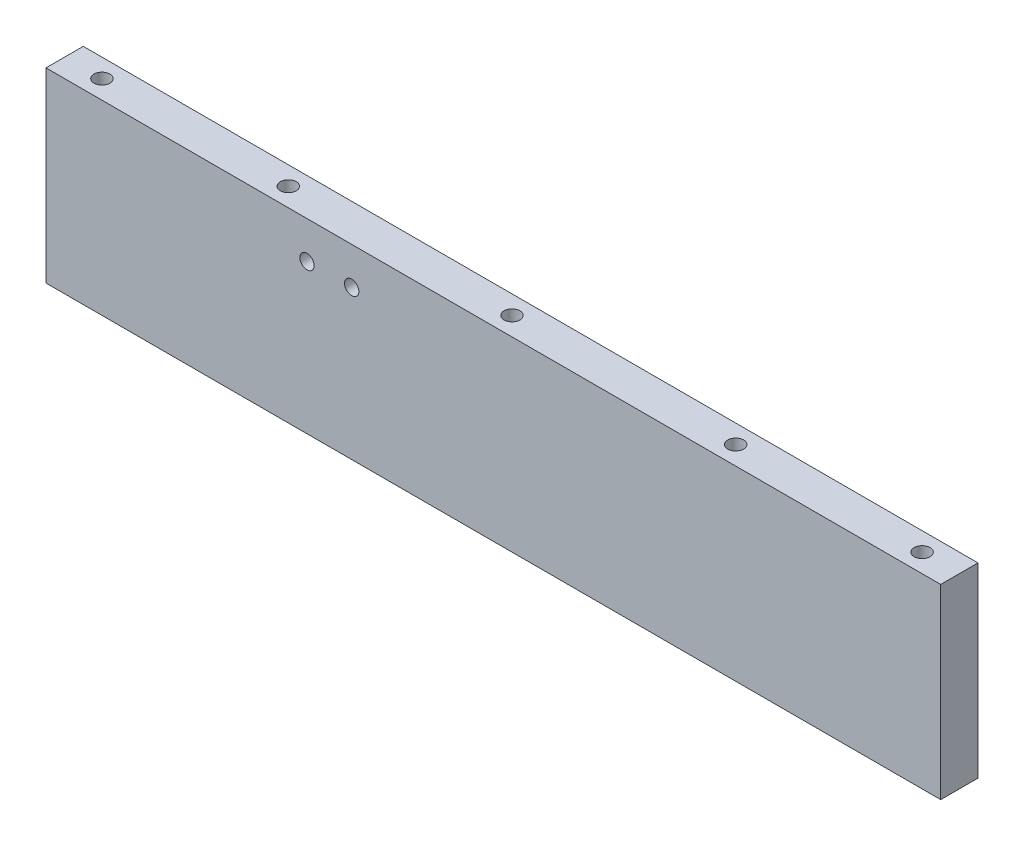
from build123d import *

# Parameters (mm, degrees)
SKETCH1_W                          = 152.4
SKETCH1_H                          = 31.75
BOSS_EXTRUDE1_DEPTH                = 6.35
F_2_CLEARANCE_HOLE1_D              = 2.4384
TAP_DRILL_FOR_6_32_TAP1_AT_2_COUNT = 2
TAP_DRILL_FOR_6_32_TAP1_AT_2_PITCH = 31.75
TAP_DRILL_FOR_6_32_TAP1_AT_3_COUNT = 2
TAP_DRILL_FOR_6_32_TAP1_AT_3_PITCH = 69.85
TAP_DRILL_FOR_6_32_TAP1_AT_4_COUNT = 2
TAP_DRILL_FOR_6_32_TAP1_AT_4_PITCH = 107.95
TAP_DRILL_FOR_6_32_TAP1_AT_5_COUNT = 2
TAP_DRILL_FOR_6_32_TAP1_AT_5_PITCH = 139.7


with BuildPart() as part:
    # Sketch1 → Boss-Extrude1 (new body)
    with BuildSketch(Plane.XY):
        Rectangle(SKETCH1_W, SKETCH1_H)
    extrude(amount=-BOSS_EXTRUDE1_DEPTH)

    # #2 Clearance Hole1 (through all)
    with Locations(Plane.XY):
        with Locations((-31.75, 9.525), (-24.13, 9.525)):
            Hole(F_2_CLEARANCE_HOLE1_D / 2)

    # Sketch7 → Tap Drill for #6-32 Tap1 (revolve, cut)
    with BuildSketch(Plane(origin=(-69.85, 15.875, -3.175), x_dir=(0, 0, 1), z_dir=(1, 0, 0))):
        Polygon((0, 0), (0, 13.51269403), (1.35255, 12.7), (1.35255, 0), align=None)
    tap_drill_for_6_32_tap1 = revolve(axis=Axis((-69.85, 22.225, -3.175), (0, -1, 0)), mode=Mode.SUBTRACT)

    # Tap Drill for #6-32 Tap1 at 2: Tap Drill for #6-32 Tap1 ×2
    with Locations(*[(i * TAP_DRILL_FOR_6_32_TAP1_AT_2_PITCH, 0, 0) for i in range(1, TAP_DRILL_FOR_6_32_TAP1_AT_2_COUNT)]):
        add(tap_drill_for_6_32_tap1, mode=Mode.SUBTRACT)

    # Tap Drill for #6-32 Tap1 at 3: Tap Drill for #6-32 Tap1 ×2
    with Locations(*[(i * TAP_DRILL_FOR_6_32_TAP1_AT_3_PITCH, 0, 0) for i in range(1, TAP_DRILL_FOR_6_32_TAP1_AT_3_COUNT)]):
        add(tap_drill_for_6_32_tap1, mode=Mode.SUBTRACT)

    # Tap Drill for #6-32 Tap1 at 4: Tap Drill for #6-32 Tap1 ×2
    with Locations(*[(i * TAP_DRILL_FOR_6_32_TAP1_AT_4_PITCH, 0, 0) for i in range(1, TAP_DRILL_FOR_6_32_TAP1_AT_4_COUNT)]):
        add(tap_drill_for_6_32_tap1, mode=Mode.SUBTRACT)

    # Tap Drill for #6-32 Tap1 at 5: Tap Drill for #6-32 Tap1 ×2
    with Locations(*[(i * TAP_DRILL_FOR_6_32_TAP1_AT_5_PITCH, 0, 0) for i in range(1, TAP_DRILL_FOR_6_32_TAP1_AT_5_COUNT)]):
        add(tap_drill_for_6_32_tap1, mode=Mode.SUBTRACT)

    # Mirror1: Tap Drill for #6-32 Tap1 across plane
    add(tap_drill_for_6_32_tap1.mirror(Plane.ZX), mode=Mode.SUBTRACT)

    # Mirror1 copy 1 sketch → Mirror1 copy 1 (revolve, cut)
    with BuildSketch(Plane(origin=(-38.1, -15.875, -3.175), x_dir=(0, 0, 1), z_dir=(1, 0, 0))):
        Polygon((0, 0), (0, -13.51269403), (1.35255, -12.7), (1.35255, 0), align=None)
    revolve(axis=Axis((-38.1, -22.225, -3.175), (0, -1, 0)), mode=Mode.SUBTRACT)

    # Mirror1 copy 2 sketch → Mirror1 copy 2 (revolve, cut)
    with BuildSketch(Plane(origin=(0, -15.875, -3.175), x_dir=(0, 0, 1), z_dir=(1, 0, 0))):
        Polygon((0, 0), (0, -13.51269403), (1.35255, -12.7), (1.35255, 0), align=None)
    revolve(axis=Axis((0, -22.225, -3.175), (0, -1, 0)), mode=Mode.SUBTRACT)

    # Mirror1 copy 3 sketch → Mirror1 copy 3 (revolve, cut)
    with BuildSketch(Plane(origin=(38.1, -15.875, -3.175), x_dir=(0, 0, 1), z_dir=(1, 0, 0))):
        Polygon((0, 0), (0, -13.51269403), (1.35255, -12.7), (1.35255, 0), align=None)
    revolve(axis=Axis((38.1, -22.225, -3.175), (0, -1, 0)), mode=Mode.SUBTRACT)

    # Mirror1 copy 4 sketch → Mirror1 copy 4 (revolve, cut)
    with BuildSketch(Plane(origin=(69.85, -15.875, -3.175), x_dir=(0, 0, 1), z_dir=(1, 0, 0))):
        Polygon((0, 0), (0, -13.51269403), (1.35255, -12.7), (1.35255, 0), align=None)
    revolve(axis=Axis((69.85, -22.225, -3.175), (0, -1, 0)), mode=Mode.SUBTRACT)


solid = part.part
